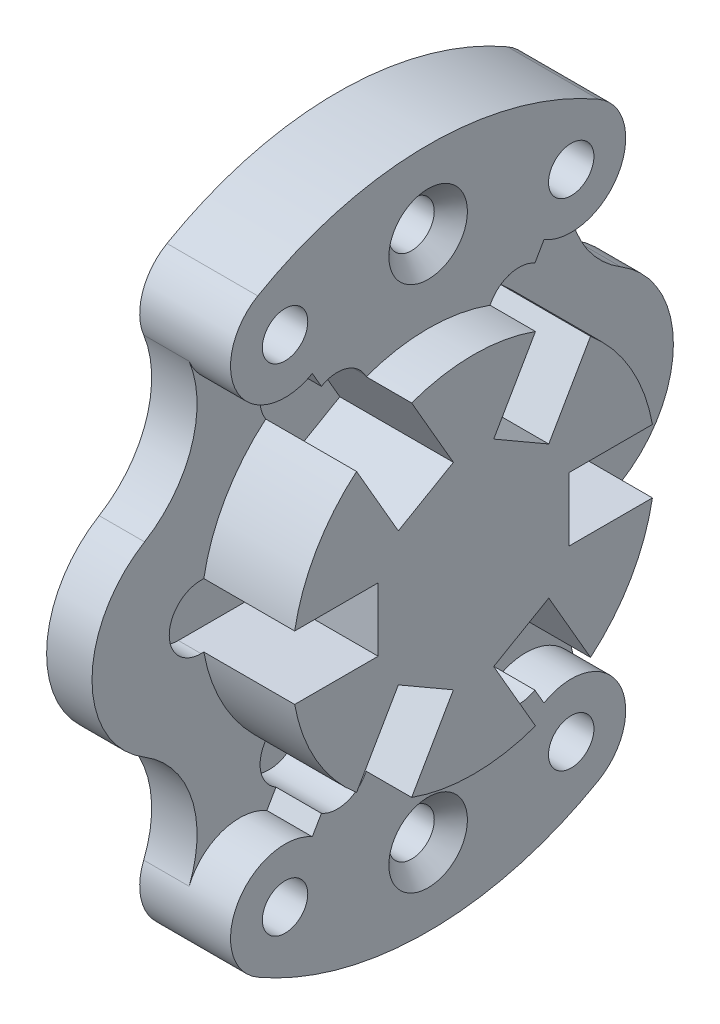
from build123d import *

# Parameters (mm, degrees)
BOSS_EXTRUDE1_DEPTH                             = 10
BOSS_EXTRUDE1_2_DEPTH                           = 10
BOSS_EXTRUDE2_DEPTH                             = 30
BOSS_EXTRUDE3_DEPTH                             = 5
SKETCH1_5_R                                     = 5
BOSS_EXTRUDE4_DEPTH                             = 20
CSK_FOR_M8_FLAT_HEAD_MACHINE_SCREW1_D           = 10
CSK_FOR_M8_FLAT_HEAD_MACHINE_SCREW1_CSINK_D     = 17.3
CSK_FOR_M8_FLAT_HEAD_MACHINE_SCREW1_CSINK_ANGLE = 90


with BuildPart() as part:
    # Sketch1 → Boss-Extrude1 (new body)
    with BuildSketch(Plane(origin=(0, 0, 0), x_dir=(0, 0, -1), z_dir=(1, 0, 0))):
        with BuildLine():
            ThreePointArc((25.753546494, 30.606451003), (34.641016151, 20), (39.382737335, 7))
            Line((39.382737335, 7), (40, 7))
            ThreePointArc((40, 7), (47, 0), (40, -7))
            Line((40, -7), (39.382737335, -7))
            ThreePointArc((39.382737335, -7), (34.641016151, -20), (25.753546494, -30.606451003))
            Line((25.753546494, -30.606451003), (26.062177826, -31.141016151))
            ThreePointArc((26.062177826, -31.141016151), (26.761480784, -36.452749467), (23.5, -40.703193978))
            Line((23.5, -40.703193978), (25.5, -44.167295593))
            ThreePointArc((25.5, -44.167295593), (35.403493203, -43.212233307), (42.62357008, -50.057802056))
            ThreePointArc((42.62357008, -50.057802056), (42.094968285, -33.486802939), (52.43535512, -20.527102646))
            ThreePointArc((52.43535512, -20.527102646), (64, 0), (52.43535512, 20.527102646))
            ThreePointArc((52.43535512, 20.527102646), (42.094968285, 33.486802939), (42.62357008, 50.057802056))
            ThreePointArc((42.62357008, 50.057802056), (35.403493203, 43.212233307), (25.5, 44.167295593))
            Line((25.5, 44.167295593), (23.5, 40.703193978))
            ThreePointArc((23.5, 40.703193978), (26.761480784, 36.452749467), (26.062177826, 31.141016151))
            Line((26.062177826, 31.141016151), (25.753546494, 30.606451003))
        make_face()
    extrude(amount=BOSS_EXTRUDE1_DEPTH)



with BuildPart() as body_2:
    # Sketch1 → Boss-Extrude1 2 (new body)
    with BuildSketch(Plane(origin=(0, 0, 0), x_dir=(0, 0, -1), z_dir=(1, 0, 0))):
        with BuildLine():
            ThreePointArc((-26.062177826, 31.141016151), (-26.761480784, 36.452749467), (-23.5, 40.703193978))
            Line((-23.5, 40.703193978), (-25.5, 44.167295593))
            ThreePointArc((-25.5, 44.167295593), (-35.403493203, 43.212233307), (-42.62357008, 50.057802056))
            ThreePointArc((-42.62357008, 50.057802056), (-42.094968285, 33.486802939), (-52.43535512, 20.527102646))
            ThreePointArc((-52.43535512, 20.527102646), (-64, 0), (-52.43535512, -20.527102646))
            ThreePointArc((-52.43535512, -20.527102646), (-42.094968285, -33.486802939), (-42.62357008, -50.057802056))
            ThreePointArc((-42.62357008, -50.057802056), (-35.403493203, -43.212233307), (-25.5, -44.167295593))
            Line((-25.5, -44.167295593), (-23.5, -40.703193978))
            ThreePointArc((-23.5, -40.703193978), (-26.761480784, -36.452749467), (-26.062177826, -31.141016151))
            Line((-26.062177826, -31.141016151), (-25.753546494, -30.606451003))
            ThreePointArc((-25.753546494, -30.606451003), (-34.641016151, -20), (-39.382737335, -7))
            Line((-39.382737335, -7), (-40, -7))
            ThreePointArc((-40, -7), (-47, 0), (-40, 7))
            Line((-40, 7), (-39.382737335, 7))
            ThreePointArc((-39.382737335, 7), (-34.641016151, 20), (-25.753546494, 30.606451003))
            Line((-25.753546494, 30.606451003), (-26.062177826, 31.141016151))
        make_face()
    extrude(amount=BOSS_EXTRUDE1_2_DEPTH)


with BuildPart() as part_1:
    add(part.part)

    add(body_2.part)  # Boss-Extrude2 merges body 2
    # Sketch1<3> → Boss-Extrude2 (add)
    with BuildSketch(Plane(origin=(0, 0, 0), x_dir=(0, 0, -1), z_dir=(1, 0, 0))):
        with BuildLine():
            Line((21, -7), (21, 7))
            Line((21, 7), (39.382737335, 7))
            ThreePointArc((39.382737335, 7), (34.641016151, 20), (25.753546494, 30.606451003))
            Line((25.753546494, 30.606451003), (16.562177826, 14.686533479))
            Line((16.562177826, 14.686533479), (4.437822174, 21.686533479))
            Line((4.437822174, 21.686533479), (13.629190841, 37.606451003))
            ThreePointArc((13.629190841, 37.606451003), (0, 40), (-13.629190841, 37.606451003))
            Line((-13.629190841, 37.606451003), (-4.437822174, 21.686533479))
            Line((-4.437822174, 21.686533479), (-16.562177826, 14.686533479))
            Line((-16.562177826, 14.686533479), (-25.753546494, 30.606451003))
            ThreePointArc((-25.753546494, 30.606451003), (-34.641016151, 20), (-39.382737335, 7))
            Line((-39.382737335, 7), (-21, 7))
            Line((-21, 7), (-21, -7))
            Line((-21, -7), (-39.382737335, -7))
            ThreePointArc((-39.382737335, -7), (-34.641016151, -20), (-25.753546494, -30.606451003))
            Line((-25.753546494, -30.606451003), (-16.562177826, -14.686533479))
            Line((-16.562177826, -14.686533479), (-4.437822174, -21.686533479))
            Line((-4.437822174, -21.686533479), (-13.629190841, -37.606451003))
            ThreePointArc((-13.629190841, -37.606451003), (0, -40), (13.629190841, -37.606451003))
            Line((13.629190841, -37.606451003), (4.437822174, -21.686533479))
            Line((4.437822174, -21.686533479), (16.562177826, -14.686533479))
            Line((16.562177826, -14.686533479), (25.753546494, -30.606451003))
            ThreePointArc((25.753546494, -30.606451003), (34.641016151, -20), (39.382737335, -7))
            Line((39.382737335, -7), (21, -7))
        make_face()
    extrude(amount=BOSS_EXTRUDE2_DEPTH)

    # Sketch1<4> → Boss-Extrude3 (add)
    with BuildSketch(Plane(origin=(0, 0, 0), x_dir=(0, 0, -1), z_dir=(1, 0, 0))):
        with BuildLine():
            Line((40, 7), (21, 7))
            Line((21, 7), (21, -7))
            Line((21, -7), (40, -7))
            ThreePointArc((40, -7), (47, 0), (40, 7))
        make_face()
        with BuildLine():
            Line((16.562177826, 14.686533479), (26.062177826, 31.141016151))
            ThreePointArc((26.062177826, 31.141016151), (23.5, 40.703193978), (13.937822174, 38.141016151))
            Line((13.937822174, 38.141016151), (4.437822174, 21.686533479))
            Line((4.437822174, 21.686533479), (16.562177826, 14.686533479))
        make_face()
        with BuildLine():
            Line((26.062177826, -31.141016151), (16.562177826, -14.686533479))
            Line((16.562177826, -14.686533479), (4.437822174, -21.686533479))
            Line((4.437822174, -21.686533479), (13.937822174, -38.141016151))
            ThreePointArc((13.937822174, -38.141016151), (23.5, -40.703193978), (26.062177826, -31.141016151))
        make_face()
        with BuildLine():
            Line((-4.437822174, 21.686533479), (-13.937822174, 38.141016151))
            ThreePointArc((-13.937822174, 38.141016151), (-23.5, 40.703193978), (-26.062177826, 31.141016151))
            Line((-26.062177826, 31.141016151), (-16.562177826, 14.686533479))
            Line((-16.562177826, 14.686533479), (-4.437822174, 21.686533479))
        make_face()
        with BuildLine():
            Line((-13.937822174, -38.141016151), (-4.437822174, -21.686533479))
            Line((-4.437822174, -21.686533479), (-16.562177826, -14.686533479))
            Line((-16.562177826, -14.686533479), (-26.062177826, -31.141016151))
            ThreePointArc((-26.062177826, -31.141016151), (-23.5, -40.703193978), (-13.937822174, -38.141016151))
        make_face()
        with BuildLine():
            Line((-21, 7), (-40, 7))
            ThreePointArc((-40, 7), (-47, 0), (-40, -7))
            Line((-40, -7), (-21, -7))
            Line((-21, -7), (-21, 7))
        make_face()
    extrude(amount=BOSS_EXTRUDE3_DEPTH)

    # Sketch1<5> → Boss-Extrude4 (add)
    # profile 1 of 2: a face of its own
    with BuildSketch(Plane(origin=(0, 0, 0), x_dir=(0, 0, -1), z_dir=(1, 0, 0))):
        with BuildLine():
            ThreePointArc((13.937822174, 38.141016151), (18.188266684, 41.402496935), (23.5, 40.703193978))
            Line((23.5, 40.703193978), (25.5, 44.167295593))
            ThreePointArc((25.5, 44.167295593), (41.892304845, 48.559600438), (37.5, 64.951905284))
            ThreePointArc((37.5, 64.951905284), (0, 75), (-37.5, 64.951905284))
            ThreePointArc((-37.5, 64.951905284), (-41.892304845, 48.559600438), (-25.5, 44.167295593))
            Line((-25.5, 44.167295593), (-23.5, 40.703193978))
            ThreePointArc((-23.5, 40.703193978), (-18.188266684, 41.402496935), (-13.937822174, 38.141016151))
            Line((-13.937822174, 38.141016151), (-13.629190841, 37.606451003))
            ThreePointArc((-13.629190841, 37.606451003), (0, 40), (13.629190841, 37.606451003))
            Line((13.629190841, 37.606451003), (13.937822174, 38.141016151))
        make_face()
        with Locations((-31.5, 54.559600438)):
            Circle(SKETCH1_5_R, mode=Mode.SUBTRACT)
        with Locations((31.5, 54.559600438)):
            Circle(SKETCH1_5_R, mode=Mode.SUBTRACT)
        with Locations((0, 58)):
            Circle(SKETCH1_5_R, mode=Mode.SUBTRACT)
    # profile 2 of 2: a face of its own
    with BuildSketch(Plane(origin=(0, 0, 0), x_dir=(0, 0, -1), z_dir=(1, 0, 0))):
        with BuildLine():
            Line((25.5, -44.167295593), (23.5, -40.703193978))
            ThreePointArc((23.5, -40.703193978), (18.188266684, -41.402496935), (13.937822174, -38.141016151))
            Line((13.937822174, -38.141016151), (13.629190841, -37.606451003))
            ThreePointArc((13.629190841, -37.606451003), (0, -40), (-13.629190841, -37.606451003))
            Line((-13.629190841, -37.606451003), (-13.937822174, -38.141016151))
            ThreePointArc((-13.937822174, -38.141016151), (-18.188266684, -41.402496935), (-23.5, -40.703193978))
            Line((-23.5, -40.703193978), (-25.5, -44.167295593))
            ThreePointArc((-25.5, -44.167295593), (-41.892304845, -48.559600438), (-37.5, -64.951905284))
            ThreePointArc((-37.5, -64.951905284), (0, -75), (37.5, -64.951905284))
            ThreePointArc((37.5, -64.951905284), (41.892304845, -48.559600438), (25.5, -44.167295593))
        make_face()
        with Locations((-31.5, -54.559600438)):
            Circle(SKETCH1_5_R, mode=Mode.SUBTRACT)
        with Locations((0, -58)):
            Circle(SKETCH1_5_R, mode=Mode.SUBTRACT)
        with Locations((31.5, -54.559600438)):
            Circle(SKETCH1_5_R, mode=Mode.SUBTRACT)
    extrude(amount=BOSS_EXTRUDE4_DEPTH)

    # CSK for M8 Flat Head Machine Screw1 (through all)
    with Locations(Plane(origin=(20, 0, 0), x_dir=(0, 0, -1), z_dir=(1, 0, 0))):
        with Locations((0, 58), (0, -58)):
            CounterSinkHole(CSK_FOR_M8_FLAT_HEAD_MACHINE_SCREW1_D / 2, CSK_FOR_M8_FLAT_HEAD_MACHINE_SCREW1_CSINK_D / 2, counter_sink_angle=CSK_FOR_M8_FLAT_HEAD_MACHINE_SCREW1_CSINK_ANGLE)


solid = part_1.part
